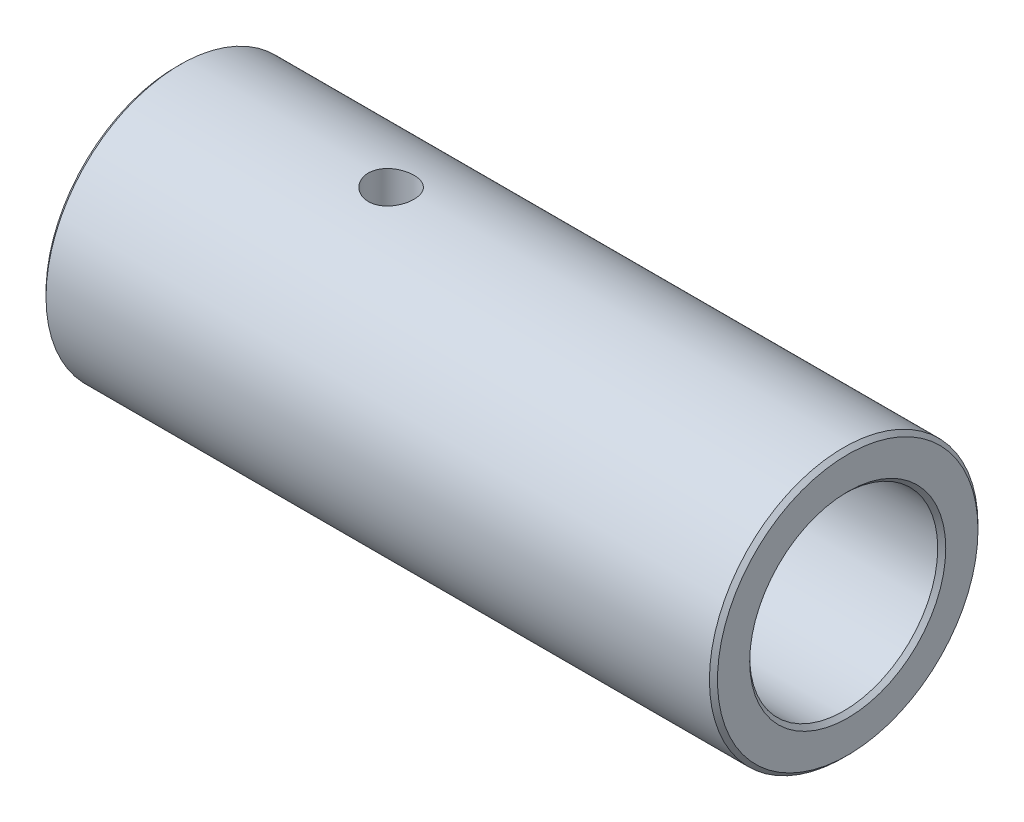
from build123d import *

# Parameters (mm, degrees)
SKETCH_1_R          = 50
SKETCH_1_R_2        = 35
EXTRUDE_1_DEPTH     = 250
SKETCH_2_R          = 8.5
CUT_EXTRUDE_1_DEPTH = 430
CHAMFER_1_SIZE      = 1.5


with BuildPart() as part:
    # 草图1 → 凸台-拉伸1 (new body)
    with BuildSketch(Plane(origin=(0, 0, 0), x_dir=(0, 0, -1), z_dir=(1, 0, 0))):
        Circle(SKETCH_1_R)
        Circle(SKETCH_1_R_2, mode=Mode.SUBTRACT)
    extrude(amount=EXTRUDE_1_DEPTH)

    # 草图2 → 切除-拉伸1 (cut, symmetric)
    with BuildSketch(Plane(origin=(0, 0, 0), x_dir=(1, 0, 0), z_dir=(0, 1, 0))):
        with Locations((80, 0)):
            Circle(SKETCH_2_R)
    extrude(amount=CUT_EXTRUDE_1_DEPTH, both=True, mode=Mode.SUBTRACT)

    # 倒角1
    chamfer_1_edges = [part.edges().sort_by_distance(p)[0] for p in [
        (0, 0, 50),
        (250, 0, 50),
        (0, 0, 35),
        (250, 0, 35),
    ]]
    chamfer(chamfer_1_edges, length=CHAMFER_1_SIZE)


solid = part.part
